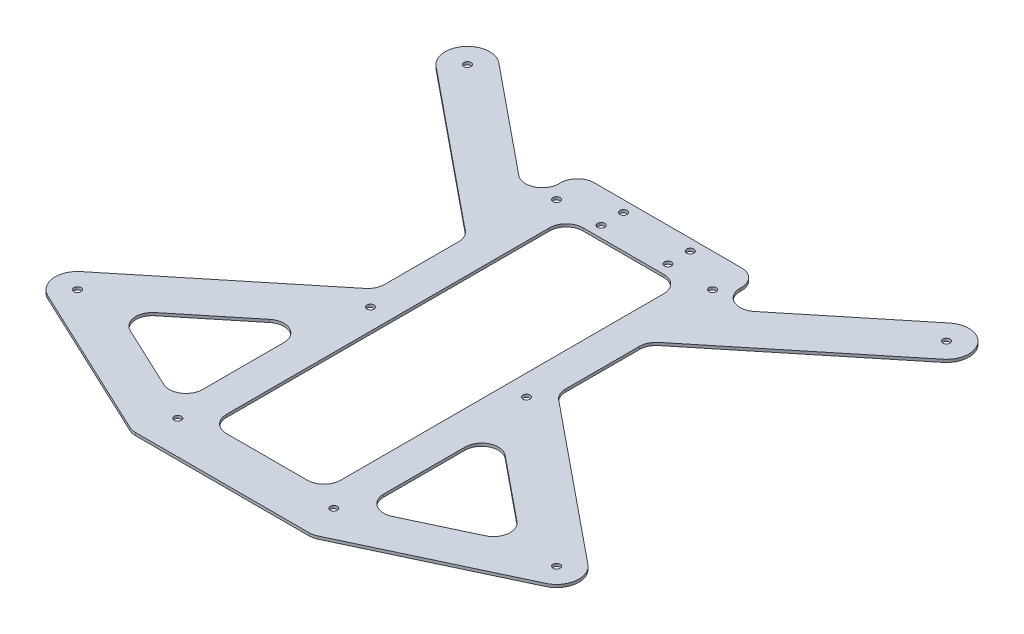
from build123d import *

# Parameters (mm, degrees)
SKETCH2_R           = 2.032
SKETCH2_W           = 65.0875
SKETCH2_H           = 203.2
BOSS_EXTRUDE1_DEPTH = 0.79375
SKETCH3_R           = 2.032
CUT_EXTRUDE1_DEPTH  = 223.550288208
FILLET1_R           = 9.525


with BuildPart() as part:
    # Sketch2 → Boss-Extrude1 (new, symmetric)
    with BuildSketch(Plane(origin=(0, 0, 0), x_dir=(1, 0, 0), z_dir=(0, 1, 0))):
        with BuildLine():
            Line((-51.59375, 58.370134809), (-128.507853241, 120.974637447))
            ThreePointArc((-128.507853241, 120.974637447), (-146.374637447, 119.142146759), (-144.542146759, 101.275362553))
            Line((-144.542146759, 101.275362553), (-51.59375, 25.619690772))
            Line((-51.59375, 25.619690772), (-51.59375, -25.619690772))
            Line((-51.59375, -25.619690772), (-144.542146759, -101.275362553))
            ThreePointArc((-144.542146759, -101.275362553), (-149.130906335, -112.668089589), (-141.929642552, -122.617599309))
            Line((-141.929642552, -122.617599309), (-51.59375, -165.1))
            Line((-51.59375, -165.1), (51.59375, -165.1))
            Line((51.59375, -165.1), (141.929642552, -122.617599309))
            ThreePointArc((141.929642552, -122.617599309), (149.130906335, -112.668089589), (144.542146759, -101.275362553))
            Line((144.542146759, -101.275362553), (51.59375, -25.619690772))
            Line((51.59375, -25.619690772), (51.59375, 25.619690772))
            Line((51.59375, 25.619690772), (144.542146759, 101.275362553))
            ThreePointArc((144.542146759, 101.275362553), (146.374637447, 119.142146759), (128.507853241, 120.974637447))
            Line((128.507853241, 120.974637447), (51.59375, 58.370134809))
            Line((51.59375, 58.370134809), (51.59375, 88.9))
            Line((51.59375, 88.9), (-51.59375, 88.9))
            Line((-51.59375, 88.9), (-51.59375, 58.370134809))
        make_face()
        with Locations(Location((-136.525, -111.125, 0), (0, 0, 270))):
            Circle(SKETCH2_R, mode=Mode.SUBTRACT)
        Polygon((-51.59375, -58.370134809), (-51.59375, -139.7), (-114.923666817, -109.917741521), align=None, mode=Mode.SUBTRACT)
        Polygon((51.59375, -139.7), (51.59375, -58.370134809), (114.923666817, -109.917741521), align=None, mode=Mode.SUBTRACT)
        with Locations(Location((136.525, -111.125, 0), (0, 0, 270))):
            Circle(SKETCH2_R, mode=Mode.SUBTRACT)
        with Locations((0, -38.1)):
            Rectangle(SKETCH2_W, SKETCH2_H, mode=Mode.SUBTRACT)
        with Locations(Location((-136.525, 111.125, 0), (0, 0, 270))):
            Circle(SKETCH2_R, mode=Mode.SUBTRACT)
        with Locations(Location((136.525, 111.125, 0), (0, 0, 270))):
            Circle(SKETCH2_R, mode=Mode.SUBTRACT)
    extrude(amount=BOSS_EXTRUDE1_DEPTH, both=True)

    # Sketch3 → Cut-Extrude1 (cut, through all)
    with BuildSketch(Plane.XZ.offset(0.79375)):
        with Locations(Location((44.45, 146.05, 0), (0, 0, 270))):
            Circle(SKETCH3_R)
        with Locations(Location((-44.45, 146.05, 0), (0, 0, 270))):
            Circle(SKETCH3_R)
        with Locations(Location((44.45, -69.85, 0), (0, 0, 270))):
            Circle(SKETCH3_R)
        with Locations(Location((-44.45, -69.85, 0), (0, 0, 270))):
            Circle(SKETCH3_R)
        with Locations(Location((-19.05, -69.85, 0), (0, 0, 270))):
            Circle(SKETCH3_R)
        with Locations(Location((19.05, -69.85, 0), (0, 0, 270))):
            Circle(SKETCH3_R)
        with Locations(Location((-19.05, -82.55, 0), (0, 0, 270))):
            Circle(SKETCH3_R)
        with Locations(Location((19.05, -82.55, 0), (0, 0, 270))):
            Circle(SKETCH3_R)
        with Locations(Location((-44.45, 36.180232558, 0), (0, 0, 270))):
            Circle(SKETCH3_R)
        with Locations(Location((44.45, 36.180232558, 0), (0, 0, 270))):
            Circle(SKETCH3_R)
    extrude(amount=-CUT_EXTRUDE1_DEPTH, mode=Mode.SUBTRACT)

    # Fillet1
    fillet1_edges = [part.edges().sort_by_distance(p)[0] for p in [
        (-51.59375, 0, 58.370134809),
        (-114.923666817, 0, 109.917741521),
        (-51.59375, 0, 139.7),
        (32.54375, 0, -63.5),
        (-32.54375, 0, -63.5),
        (-32.54375, 0, 139.7),
        (32.54375, 0, 139.7),
        (51.59375, 0, 58.370134809),
        (51.59375, 0, 139.7),
        (114.923666817, 0, 109.917741521),
        (-51.59375, 0, 25.619690772),
        (-51.59375, 0, -25.619690772),
        (-51.59375, 0, -58.370134809),
        (-51.59375, 0, -88.9),
        (51.59375, 0, -88.9),
        (51.59375, 0, -58.370134809),
        (51.59375, 0, -25.619690772),
        (51.59375, 0, 25.619690772),
        (51.59375, 0, 165.1),
        (-51.59375, 0, 165.1),
    ]]
    fillet(fillet1_edges, radius=FILLET1_R)


solid = part.part
